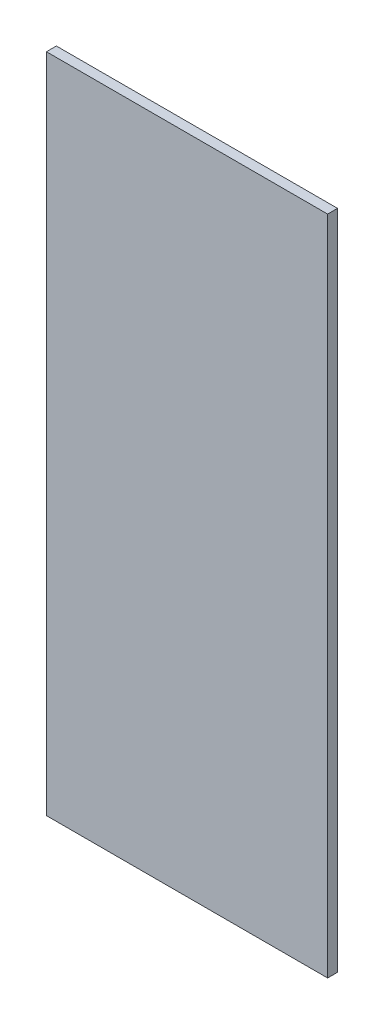
from build123d import *

# Parameters (mm, degrees)
SKETCH1_W           = 170
SKETCH1_H           = 400
BOSS_EXTRUDE1_DEPTH = 6


with BuildPart() as part:
    # Sketch1 → Boss-Extrude1 (new body)
    with BuildSketch(Plane.XY):
        with Locations((56.428571429, 177.104761905)):
            Rectangle(SKETCH1_W, SKETCH1_H)
    extrude(amount=BOSS_EXTRUDE1_DEPTH)


solid = part.part
